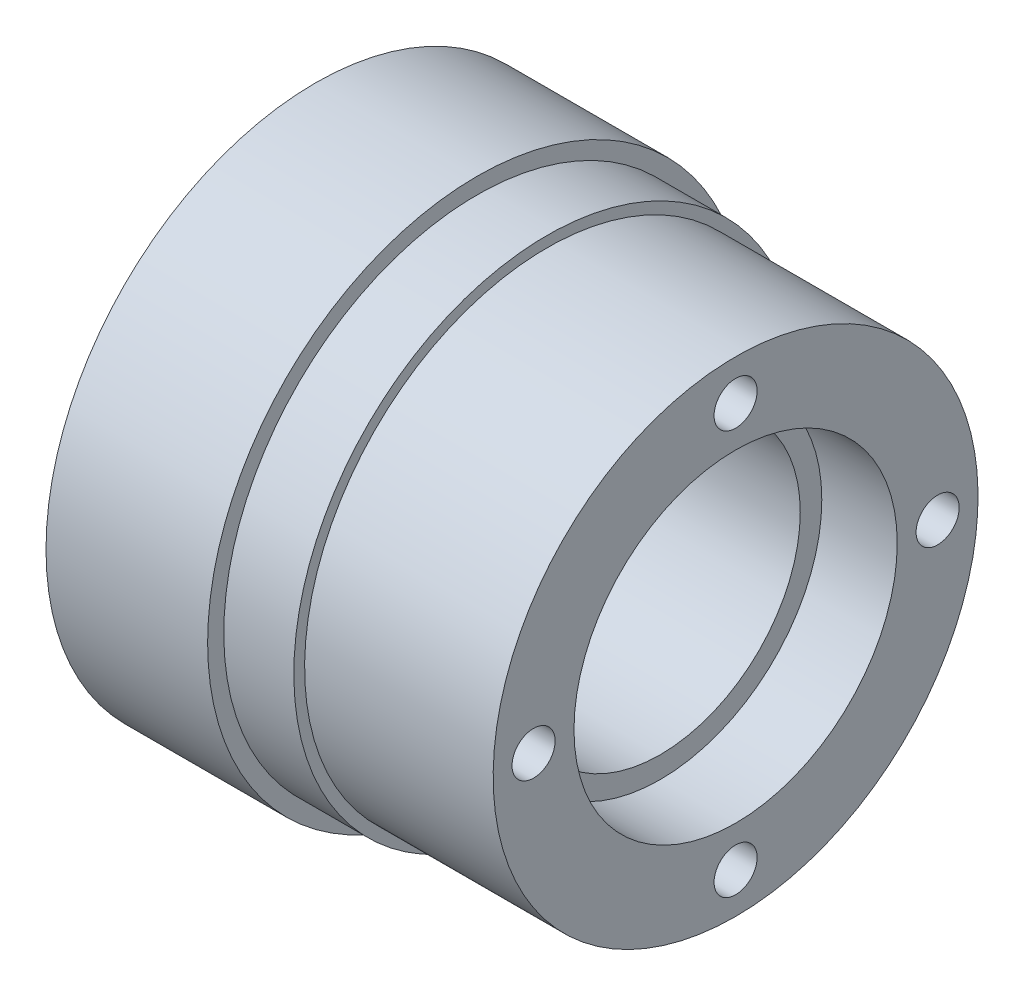
from build123d import *

# Parameters (mm, degrees)
SKETCH2_R          = 2
CUT_EXTRUDE1_DEPTH = 10
SKETCH3_R          = 2
CUT_EXTRUDE2_DEPTH = 10


with BuildPart() as part:
    # Sketch1 → Revolve1 (revolve)
    with BuildSketch(Plane.XY, mode=Mode.PRIVATE) as revolve1_sk:
        Polygon((-19.5, 13.5), (-15.3, 13.5), (-15.3, 13), (12.5, 13), (12.5, 15), (19.5, 15), (19.5, 22.5), (2, 22.5), (2, 23.5), (-4.5, 23.5), (-4.5, 25), (-19.5, 25), align=None)
    revolve(revolve1_sk.sketch.rotate(Axis((-19.5, 0, 0), (1, 0, 0)), 180), axis=Axis((-19.5, 0, 0), (1, 0, 0)))

    # Sketch2 → Cut-Extrude1 (cut)
    with BuildSketch(Plane(origin=(19.5, 0, 0), x_dir=(0, 0, -1), z_dir=(1, 0, 0))):
        with Locations((0, 18.75)):
            Circle(SKETCH2_R)
        with Locations((18.75, 0)):
            Circle(SKETCH2_R)
        with Locations((0, -18.75)):
            Circle(SKETCH2_R)
        with Locations((-18.75, 0)):
            Circle(SKETCH2_R)
    extrude(amount=-CUT_EXTRUDE1_DEPTH, mode=Mode.SUBTRACT)

    # Sketch3 → Cut-Extrude2 (cut)
    with BuildSketch(Plane.ZY.offset(19.5)):
        with Locations((0, 19.25)):
            Circle(SKETCH3_R)
        with Locations((19.25, 0)):
            Circle(SKETCH3_R)
        with Locations((0, -19.25)):
            Circle(SKETCH3_R)
        with Locations((-19.25, 0)):
            Circle(SKETCH3_R)
    extrude(amount=-CUT_EXTRUDE2_DEPTH, mode=Mode.SUBTRACT)


solid = part.part
